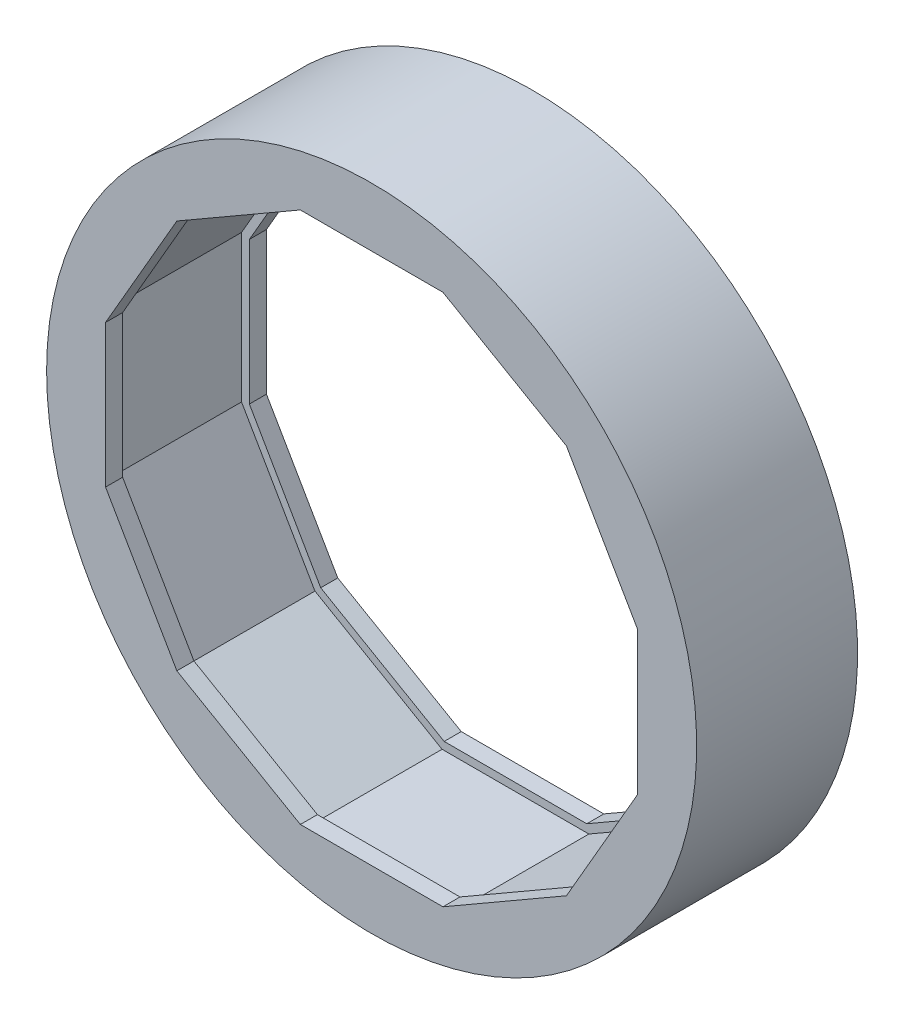
from build123d import *

# Parameters (mm, degrees)
S01_80_MM_TYRE_AND_TWO_INWARD_BEAD_LIP_R       = 40
F_01_80_MM_TYRE_AND_TWO_INWARD_BEAD_LIPS_DEPTH = 19.8
F_02_START                                     = 2.1
F_02_CENTRAL_KEYED_DRIVE_RECESS_BETWEEN_DEPTH  = 15.6


with BuildPart() as part:
    # S01 - 80 mm tyre and two inward bead lips → 01 - 80 mm tyre and two inward bead lips (new body)
    with BuildSketch(Plane.XY):
        with Locations(Location((0, 0, 0), (0, 0, 180))):
            Circle(S01_80_MM_TYRE_AND_TWO_INWARD_BEAD_LIP_R)
        Polygon((32.744885511, 8.773965629), (23.970919882, 23.970919882), (8.773965629, 32.744885511), (-8.773965629, 32.744885511), (-23.970919882, 23.970919882), (-32.744885511, 8.773965629), (-32.744885511, -8.773965629), (-23.970919882, -23.970919882), (-8.773965629, -32.744885511), (8.773965629, -32.744885511), (23.970919882, -23.970919882), (32.744885511, -8.773965629), align=None, mode=Mode.SUBTRACT)
    extrude(amount=F_01_80_MM_TYRE_AND_TWO_INWARD_BEAD_LIPS_DEPTH)

    # S02 - Central keyed drive recess between end beads → 02 - Central keyed drive recess between end beads (cut)
    with BuildSketch(Plane.XY.offset(F_02_START)):
        Polygon((33.710811337, 9.032784674), (24.678026663, 24.678026663), (9.032784674, 33.710811337), (-9.032784674, 33.710811337), (-24.678026663, 24.678026663), (-33.710811337, 9.032784674), (-33.710811337, -9.032784674), (-24.678026663, -24.678026663), (-9.032784674, -33.710811337), (9.032784674, -33.710811337), (24.678026663, -24.678026663), (33.710811337, -9.032784674), align=None)
    extrude(amount=F_02_CENTRAL_KEYED_DRIVE_RECESS_BETWEEN_DEPTH, mode=Mode.SUBTRACT)


solid = part.part
